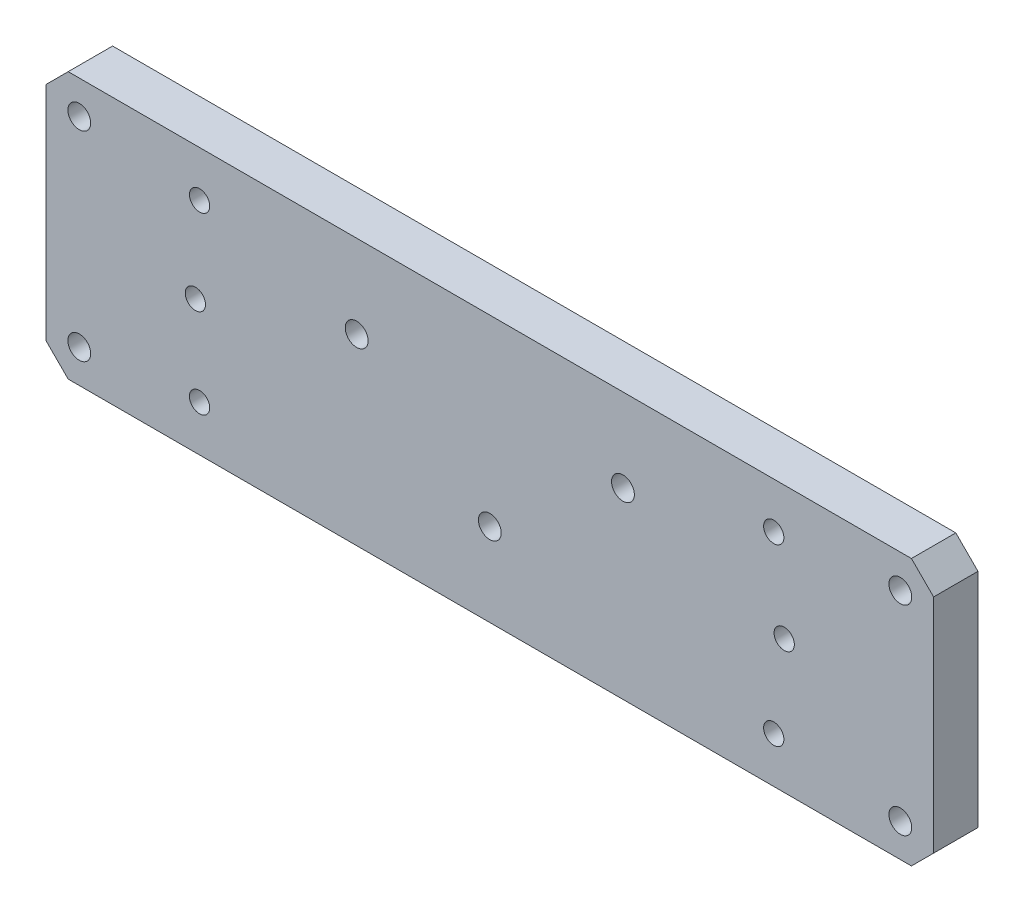
from build123d import *

# Parameters (mm, degrees)
SKETCH1_W                                       = 254
SKETCH1_H                                       = 76.2
BOSS_EXTRUDE1_DEPTH                             = 12.7
F_1_4_CLEARANCE_HOLE1_D                         = 6.5278
CHAMFER1_SIZE                                   = 6.35
CSK_FOR_M5_FLAT_HEAD_MACHINE_SCREW1_D           = 5.8
CSK_FOR_M5_FLAT_HEAD_MACHINE_SCREW1_CSINK_D     = 10.4
CSK_FOR_M5_FLAT_HEAD_MACHINE_SCREW1_CSINK_ANGLE = 90


with BuildPart() as part:
    # Sketch1 → Boss-Extrude1 (new body)
    with BuildSketch(Plane.XY):
        Rectangle(SKETCH1_W, SKETCH1_H)
    extrude(amount=BOSS_EXTRUDE1_DEPTH)

    # 1/4 Clearance Hole1 (through all)
    with Locations(Plane.XY.offset(12.7)):
        with Locations((38.1, 14.2875), (-117.475, -28.575), (-117.475, 28.575), (117.475, -28.575), (117.475, 28.575), (-38.1, 14.2875), (0, -14.2875)):
            Hole(F_1_4_CLEARANCE_HOLE1_D / 2)

    # Chamfer1
    chamfer1_edges = [part.edges().sort_by_distance(p)[0] for p in [
        (-127, 38.1, 6.35),
        (127, 38.1, 6.35),
        (127, -38.1, 6.35),
        (-127, -38.1, 6.35),
    ]]
    chamfer(chamfer1_edges, length=CHAMFER1_SIZE)

    # CSK for M5 Flat Head Machine Screw1 (through all)
    with Locations(Plane(origin=(0, 0, 0), x_dir=(-1, 0, 0), z_dir=(0, 0, -1))):
        with Locations((-81.25, -25), (-81.25, 25), (83.05, 25), (83.05, -25), (-84.25, 0), (84.25, 0)):
            CounterSinkHole(CSK_FOR_M5_FLAT_HEAD_MACHINE_SCREW1_D / 2, CSK_FOR_M5_FLAT_HEAD_MACHINE_SCREW1_CSINK_D / 2, counter_sink_angle=CSK_FOR_M5_FLAT_HEAD_MACHINE_SCREW1_CSINK_ANGLE)


solid = part.part
